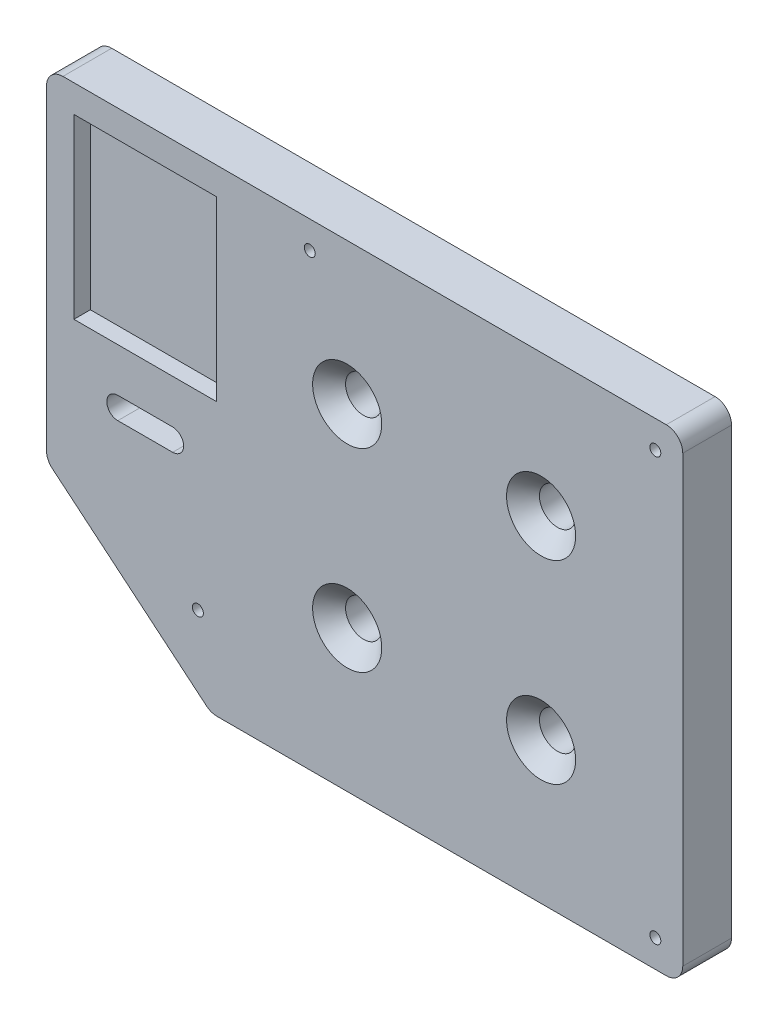
from build123d import *

# Parameters (mm, degrees)
SKETCH1_R                                       = 37.5
BOSS_EXTRUDE1_DEPTH                             = 6
SKETCH2_R                                       = 31.7
CUT_EXTRUDE1_DEPTH                              = 6
SKETCH3_W                                       = 85
SKETCH3_H                                       = 85
BOSS_EXTRUDE2_DEPTH                             = 25.4
FILLET2_R                                       = 4
SKETCH4_W                                       = 65
SKETCH4_H                                       = 65
CUT_EXTRUDE2_DEPTH                              = 16.51
CSK_FOR_M6_FLAT_HEAD_MACHINE_SCREW1_D           = 6.6
CSK_FOR_M6_FLAT_HEAD_MACHINE_SCREW1_CSINK_D     = 12.6
CSK_FOR_M6_FLAT_HEAD_MACHINE_SCREW1_CSINK_ANGLE = 90
SKETCH8_W                                       = 85
SKETCH8_H                                       = 85
CUT_EXTRUDE3_DEPTH                              = 16.51
SKETCH9_W                                       = 116
SKETCH9_H                                       = 87
SKETCH9_W_2                                     = 85
SKETCH9_H_2                                     = 85
BOSS_EXTRUDE3_DEPTH                             = 8.89
CUT_EXTRUDE4_DEPTH                              = 8.89
SKETCH11_W                                      = 26
SKETCH11_H                                      = 32.35
CUT_EXTRUDE5_DEPTH                              = 3
CUT_EXTRUDE6_DEPTH                              = 8.89
SKETCH14_R                                      = 1
CUT_EXTRUDE7_DEPTH                              = 8.89
FILLET3_R                                       = 3


with BuildPart() as part:
    # Sketch1 → Boss-Extrude1 (new body)
    with BuildSketch(Plane.XY):
        Circle(SKETCH1_R)
    extrude(amount=-BOSS_EXTRUDE1_DEPTH)

    # Sketch2 → Cut-Extrude1 (cut)
    with BuildSketch(Plane(origin=(0, 0, -6), x_dir=(-1, 0, 0), z_dir=(0, 0, -1))):
        Circle(SKETCH2_R)
    extrude(amount=-CUT_EXTRUDE1_DEPTH, mode=Mode.SUBTRACT)

    # Sketch3 → Boss-Extrude2 (add)
    with BuildSketch(Plane.XY):
        Rectangle(SKETCH3_W, SKETCH3_H)
    extrude(amount=BOSS_EXTRUDE2_DEPTH)

    # Fillet2
    fillet2_edges = [part.edges().sort_by_distance(p)[0] for p in [
        (-37.5, 0, 0),
    ]]
    fillet(fillet2_edges, radius=FILLET2_R)

    # Sketch4 → Cut-Extrude2 (cut)
    with BuildSketch(Plane.XY.offset(25.4)):
        Rectangle(SKETCH4_W, SKETCH4_H)
    extrude(amount=-CUT_EXTRUDE2_DEPTH, mode=Mode.SUBTRACT)

    # CSK for M6 Flat Head Machine Screw1 (through all)
    with Locations(Plane.XY.offset(8.89)):
        with Locations((-17.67766953, 17.67766953), (-17.67766953, -17.67766953), (17.67766953, -17.67766953), (17.67766953, 17.67766953)):
            CounterSinkHole(CSK_FOR_M6_FLAT_HEAD_MACHINE_SCREW1_D / 2, CSK_FOR_M6_FLAT_HEAD_MACHINE_SCREW1_CSINK_D / 2, counter_sink_angle=CSK_FOR_M6_FLAT_HEAD_MACHINE_SCREW1_CSINK_ANGLE)

    # Sketch8 → Cut-Extrude3 (cut)
    with BuildSketch(Plane.XY.offset(25.4)):
        Rectangle(SKETCH8_W, SKETCH8_H)
    extrude(amount=-CUT_EXTRUDE3_DEPTH, mode=Mode.SUBTRACT)

    # Sketch9 → Boss-Extrude3 (add)
    with BuildSketch(Plane.XY.offset(8.89)):
        with Locations((-14.5, 0)):
            Rectangle(SKETCH9_W, SKETCH9_H)
        Rectangle(SKETCH9_W_2, SKETCH9_H_2, mode=Mode.SUBTRACT)
    extrude(amount=-BOSS_EXTRUDE3_DEPTH)

    # Sketch12 → Cut-Extrude4 (cut)
    with BuildSketch(Plane.XY.offset(8.89)):
        Polygon((-42.5, -43.5), (-72.5, -18.5), (-72.5, -43.5), align=None)
    extrude(amount=-CUT_EXTRUDE4_DEPTH, mode=Mode.SUBTRACT)

    # Sketch11 → Cut-Extrude5 (cut)
    with BuildSketch(Plane.XY.offset(8.89)):
        with Locations((-54.5, 22.325)):
            Rectangle(SKETCH11_W, SKETCH11_H)
    extrude(amount=-CUT_EXTRUDE5_DEPTH, mode=Mode.SUBTRACT)

    # Sketch13 → Cut-Extrude6 (cut)
    with BuildSketch(Plane.XY.offset(8.89)):
        with BuildLine():
            Line((-49.5, -5.85), (-59.5, -5.85))
            ThreePointArc((-59.5, -5.85), (-61.5, -3.85), (-59.5, -1.85))
            Line((-59.5, -1.85), (-49.5, -1.85))
            ThreePointArc((-49.5, -1.85), (-47.5, -3.85), (-49.5, -5.85))
        make_face()
    extrude(amount=-CUT_EXTRUDE6_DEPTH, mode=Mode.SUBTRACT)

    # Sketch14 → Cut-Extrude7 (cut)
    with BuildSketch(Plane.XY.offset(8.89)):
        with Locations((38.5, -38.5)):
            Circle(SKETCH14_R)
        with Locations((38.5, 38.5)):
            Circle(SKETCH14_R)
        with Locations((-24.5, 38.5)):
            Circle(SKETCH14_R)
        with Locations((-44.898080814, -28.46206612)):
            Circle(SKETCH14_R)
    extrude(amount=-CUT_EXTRUDE7_DEPTH, mode=Mode.SUBTRACT)

    # Fillet3
    fillet3_edges = [part.edges().sort_by_distance(p)[0] for p in [
        (43.5, 43.5, 4.445),
        (43.5, -43.5, 4.445),
        (-72.5, 43.5, 4.445),
        (-72.5, -18.5, 4.445),
        (-42.5, -43.5, 4.445),
    ]]
    fillet(fillet3_edges, radius=FILLET3_R)


solid = part.part
